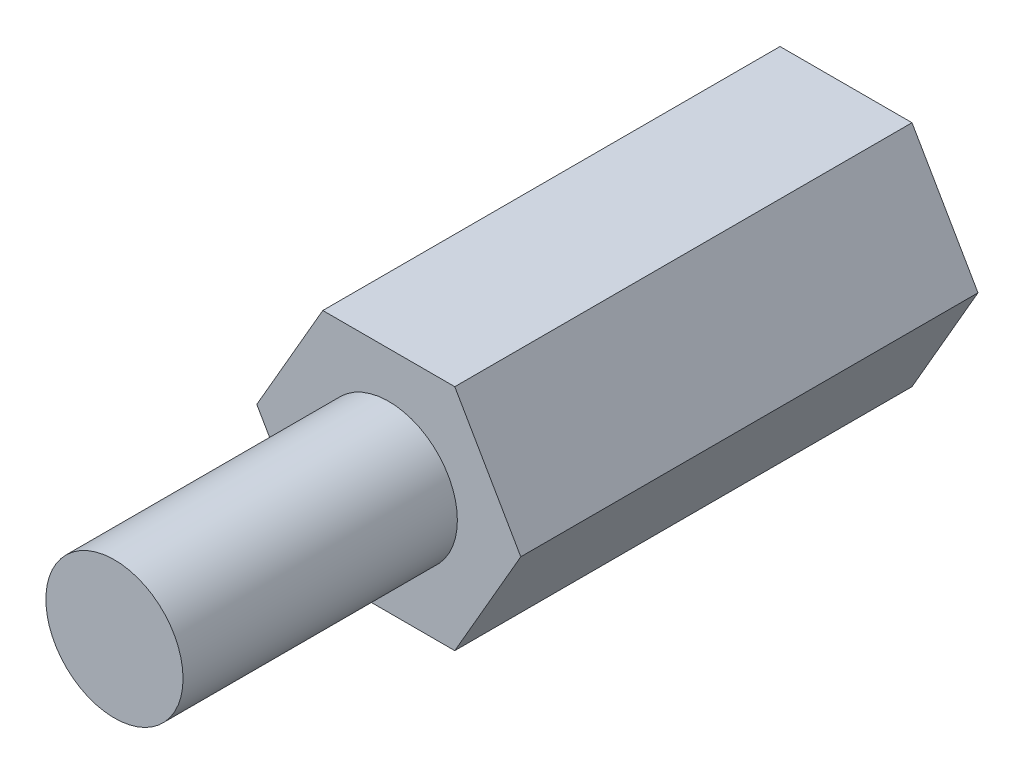
from build123d import *

# Parameters (mm, degrees)
EXTRUDE_1_DEPTH = 10
SKETCH_2_R      = 1.5
EXTRUDE_2_DEPTH = 6
M3X0_5_1_D      = 2.5
M3X0_5_1_DEPTH  = 6.5
M3X0_5_1_TIP    = 0.751075774


with BuildPart() as part:
    # 草图1 → 拉伸1 (new body)
    with BuildSketch(Plane.XY):
        Polygon((1.443375673, -2.5), (2.886751346, 0), (1.443375673, 2.5), (-1.443375673, 2.5), (-2.886751346, 0), (-1.443375673, -2.5), align=None)
    extrude(amount=EXTRUDE_1_DEPTH)

    # 草图2 → 拉伸2 (add)
    with BuildSketch(Plane.XY.offset(10)):
        Circle(SKETCH_2_R)
    extrude(amount=EXTRUDE_2_DEPTH)

    # M3x0.5 螺纹孔1
    with Locations(Plane(origin=(0, 0, 0), x_dir=(-1, 0, 0), z_dir=(0, 0, -1))):
        with Locations((0, 0)):
            Hole(M3X0_5_1_D / 2, depth=M3X0_5_1_DEPTH)
            with Locations((0, 0, -(M3X0_5_1_DEPTH + M3X0_5_1_TIP / 2))):  # 118° drill point
                Cone(0, M3X0_5_1_D / 2, M3X0_5_1_TIP, mode=Mode.SUBTRACT)


solid = part.part
